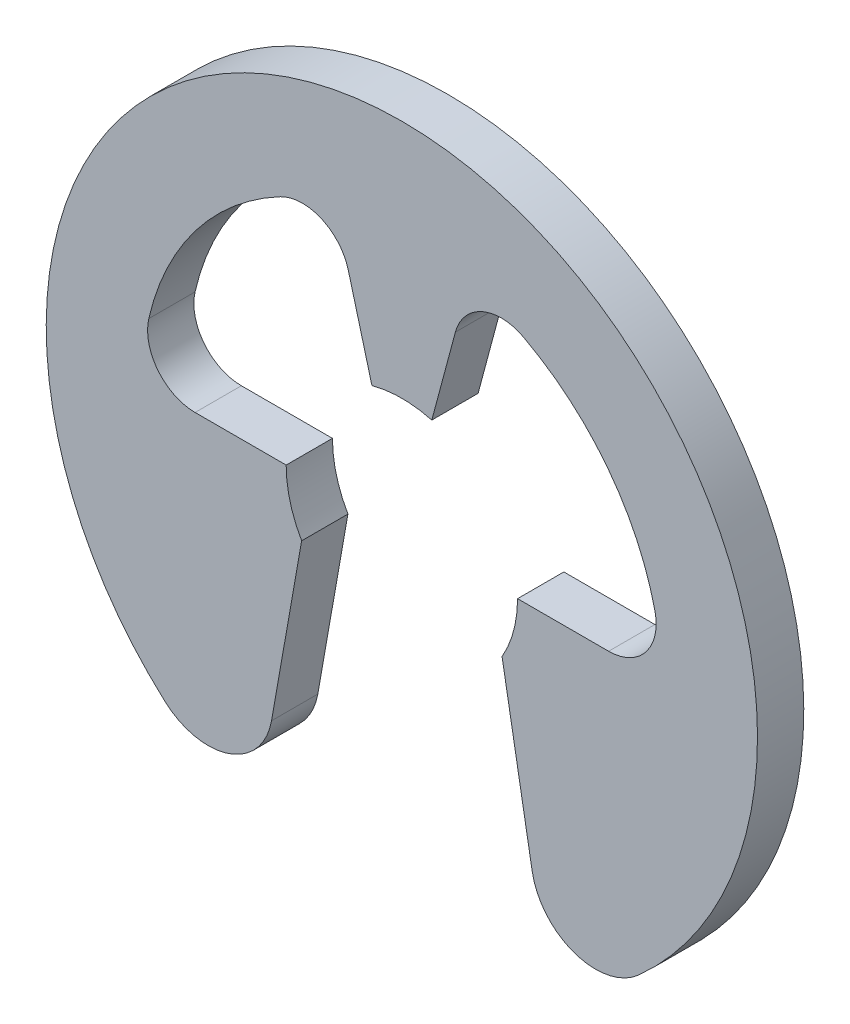
from build123d import *

# Parameters (mm, degrees)
BODY_DEPTH = 0.635


with BuildPart() as part:
    # BodySke → Body (new body)
    with BuildSketch(Plane.XY):
        with BuildLine():
            Line((1.374815329, -0.79375), (1.788417353, -3.139403641))
            ThreePointArc((1.788417353, -3.139403641), (2.367614778, -3.819569591), (3.243815561, -3.645306675))
            ThreePointArc((3.243815561, -3.645306675), (0, 4.879610656), (-3.243815561, -3.645306675))
            ThreePointArc((-3.243815561, -3.645306675), (-2.367614778, -3.819569591), (-1.788417353, -3.139403641))
            Line((-1.788417353, -3.139403641), (-1.374815329, -0.79375))
            ThreePointArc((-1.374815329, -0.79375), (-1.533407249, -0.410875234), (-1.5875, 0))
            Line((-1.5875, 0), (-2.837007574, 0))
            ThreePointArc((-2.837007574, 0), (-3.346928134, 0.245791504), (-3.472292535, 0.797802561))
            ThreePointArc((-3.472292535, 0.797802561), (-2.826532619, 2.168874761), (-1.669313536, 3.147490539))
            ThreePointArc((-1.669313536, 3.147490539), (-1.103665105, 3.169268801), (-0.734271591, 2.740338885))
            Line((-0.734271591, 2.740338885), (-0.410875234, 1.533407249))
            ThreePointArc((-0.410875234, 1.533407249), (0, 1.5875), (0.410875234, 1.533407249))
            Line((0.410875234, 1.533407249), (0.734271591, 2.740338885))
            ThreePointArc((0.734271591, 2.740338885), (1.103665105, 3.169268801), (1.669313536, 3.147490539))
            ThreePointArc((1.669313536, 3.147490539), (2.826532619, 2.168874761), (3.472292535, 0.797802561))
            ThreePointArc((3.472292535, 0.797802561), (3.346928134, 0.245791504), (2.837007574, 0))
            Line((2.837007574, 0), (1.5875, 0))
            ThreePointArc((1.5875, 0), (1.533407249, -0.410875234), (1.374815329, -0.79375))
        make_face()
    extrude(amount=-BODY_DEPTH)


solid = part.part
